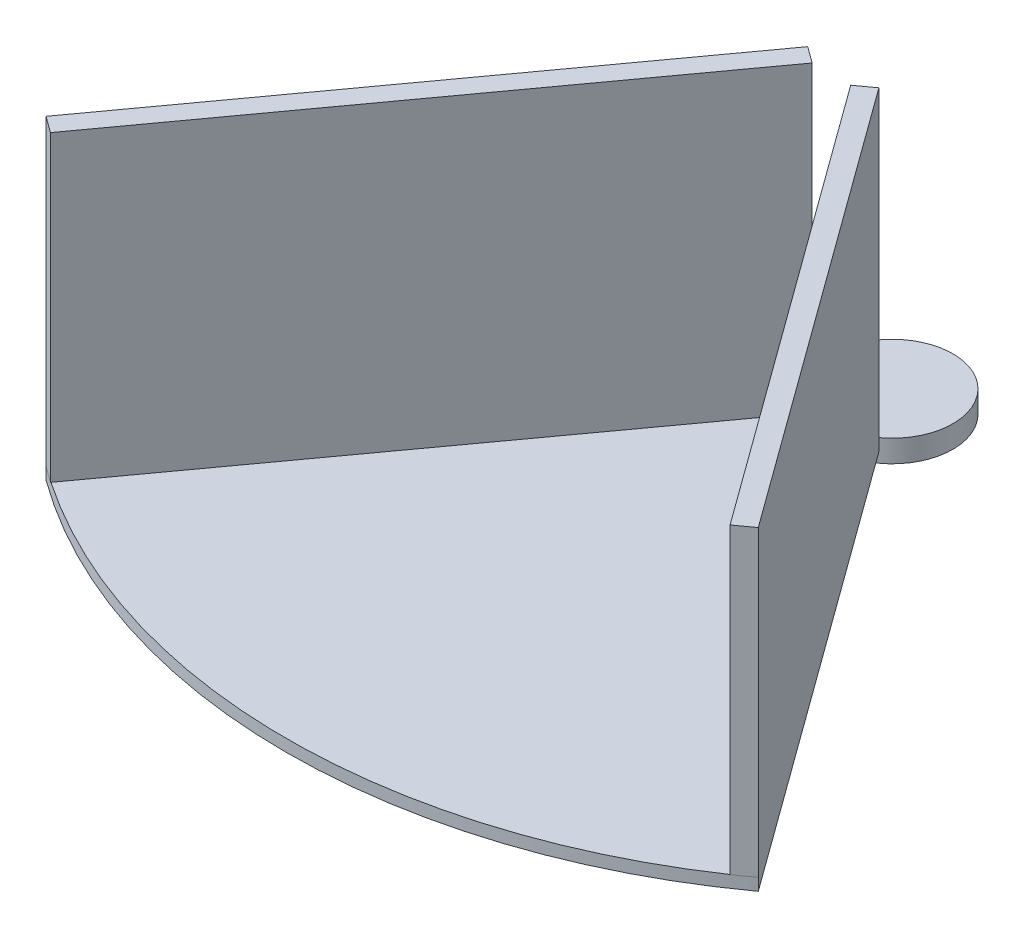
from build123d import *

# Parameters (mm, degrees)
SKETCH1_R           = 6
SKETCH1_R_2         = 3.175
BOSS_EXTRUDE1_DEPTH = 16
SKETCH2_R           = 30
BOSS_EXTRUDE2_DEPTH = 5
BOSS_EXTRUDE3_DEPTH = 6
BOSS_EXTRUDE4_DEPTH = 150


with BuildPart() as part:
    # Sketch1 → Boss-Extrude1 (new body)
    with BuildSketch(Plane(origin=(0, 0, 0), x_dir=(1, 0, 0), z_dir=(0, 1, 0))):
        with Locations(Location((0, 0, 0), (0, 0, 270))):
            Circle(SKETCH1_R)
        with Locations(Location((0, 0, 0), (0, 0, 270))):
            Circle(SKETCH1_R_2, mode=Mode.SUBTRACT)
    extrude(amount=BOSS_EXTRUDE1_DEPTH)

    # Sketch2 → Boss-Extrude2 (add)
    with BuildSketch(Plane(origin=(0, 16, 0), x_dir=(1, 0, 0), z_dir=(0, 1, 0))):
        with Locations(Location((0, 0, 0), (0, 0, 270))):
            Circle(SKETCH2_R)
    extrude(amount=BOSS_EXTRUDE2_DEPTH)

    # Sketch3 → Boss-Extrude3 (add)
    with BuildSketch(Plane(origin=(0, 21, 0), x_dir=(1, 0, 0), z_dir=(0, 1, 0))):
        with BuildLine():
            Line((17.633557569, -24.270509831), (176.335575688, -242.705098312))
            ThreePointArc((176.335575688, -242.705098312), (0, -300), (-176.335575688, -242.705098312))
            Line((-176.335575688, -242.705098312), (-17.633557569, -24.270509831))
            ThreePointArc((-17.633557569, -24.270509831), (0, 30), (17.633557569, -24.270509831))
        make_face()
    extrude(amount=BOSS_EXTRUDE3_DEPTH)

    # Sketch4 → Boss-Extrude4 (add)
    with BuildSketch(Plane(origin=(0, 27, 0), x_dir=(1, 0, 0), z_dir=(0, 1, 0))):
        Polygon((-176.335575688, -242.705098312), (-17.633557569, -24.270509831), (-9.543387625, -30.148362354), (-168.245405744, -248.582950835), align=None)
        Polygon((17.633557569, -24.270509831), (176.335575688, -242.705098312), (168.245405744, -248.582950835), (9.543387625, -30.148362354), align=None)
    extrude(amount=BOSS_EXTRUDE4_DEPTH)


solid = part.part
